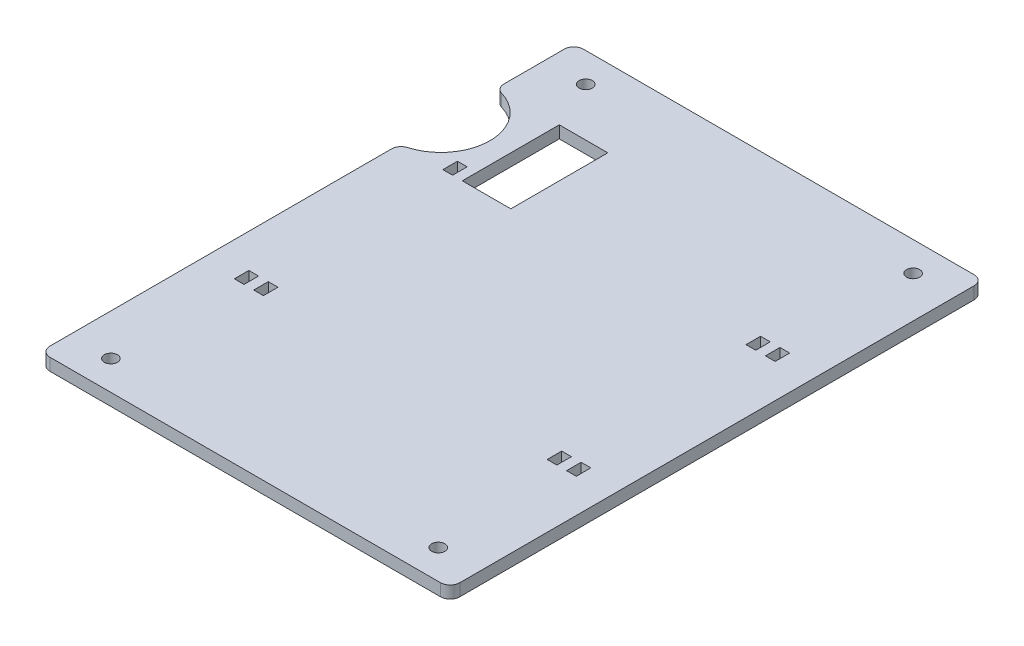
from build123d import *

# Parameters (mm, degrees)
SKETCH1_W           = 107.315
SKETCH1_H           = 139.7
SKETCH1_R           = 1.7272
BOSS_EXTRUDE1_DEPTH = 3.2004
SKETCH2_W           = 12.7
SKETCH2_H           = 25.4
CUT_EXTRUDE1_DEPTH  = 3.2004
FILLET1_R           = 2.54
SKETCH3_W           = 2.54
SKETCH3_H           = 3.81
CUT_EXTRUDE2_DEPTH  = 3.2004


with BuildPart() as part:
    # Sketch1 → Boss-Extrude1 (new body)
    with BuildSketch(Plane(origin=(0, 0, 0), x_dir=(1, 0, 0), z_dir=(0, 1, 0))):
        with Locations((53.6575, 69.85)):
            Rectangle(SKETCH1_W, SKETCH1_H)
        with Locations(Location((10.795, 132.0165, 0), (0, 0, 270))):
            Circle(SKETCH1_R, mode=Mode.SUBTRACT)
        with Locations(Location((96.52, 132.0165, 0), (0, 0, 270))):
            Circle(SKETCH1_R, mode=Mode.SUBTRACT)
        with Locations(Location((96.52, 7.6835, 0), (0, 0, 270))):
            Circle(SKETCH1_R, mode=Mode.SUBTRACT)
        with Locations(Location((10.795, 7.6835, 0), (0, 0, 270))):
            Circle(SKETCH1_R, mode=Mode.SUBTRACT)
    extrude(amount=BOSS_EXTRUDE1_DEPTH)

    # Sketch2 → Cut-Extrude1 (cut)
    with BuildSketch(Plane(origin=(0, 3.2004, 0), x_dir=(1, 0, 0), z_dir=(0, 1, 0))):
        with BuildLine():
            Line((0, 119.38), (0, 93.98))
            ThreePointArc((0, 93.98), (11.036508986, 106.68), (0, 119.38))
        make_face()
        with Locations((22.86, 106.68)):
            Rectangle(SKETCH2_W, SKETCH2_H)
    extrude(amount=-CUT_EXTRUDE1_DEPTH, mode=Mode.SUBTRACT)

    # Fillet1
    fillet1_edges = [part.edges().sort_by_distance(p)[0] for p in [
        (0, 1.6002, -119.38),
        (0, 1.6002, -93.98),
        (0, 1.6002, -139.7),
        (107.315, 1.6002, -139.7),
        (107.315, 1.6002, 0),
        (0, 1.6002, 0),
    ]]
    fillet(fillet1_edges, radius=FILLET1_R)

    # Sketch3 → Cut-Extrude2 (cut)
    with BuildSketch(Plane(origin=(0, 3.2004, 0), x_dir=(1, 0, 0), z_dir=(0, 1, 0))):
        with Locations((92.075, 43.815)):
            Rectangle(SKETCH3_W, SKETCH3_H)
        with Locations((12.7, 95.885)):
            Rectangle(SKETCH3_W, SKETCH3_H)
        with Locations((97.155, 43.815)):
            Rectangle(SKETCH3_W, SKETCH3_H)
        with Locations((97.155, 95.885)):
            Rectangle(SKETCH3_W, SKETCH3_H)
        with Locations((92.075, 95.885)):
            Rectangle(SKETCH3_W, SKETCH3_H)
        with Locations((10.16, 43.815)):
            Rectangle(SKETCH3_W, SKETCH3_H)
        with Locations((15.24, 43.815)):
            Rectangle(SKETCH3_W, SKETCH3_H)
    extrude(amount=-CUT_EXTRUDE2_DEPTH, mode=Mode.SUBTRACT)


solid = part.part
